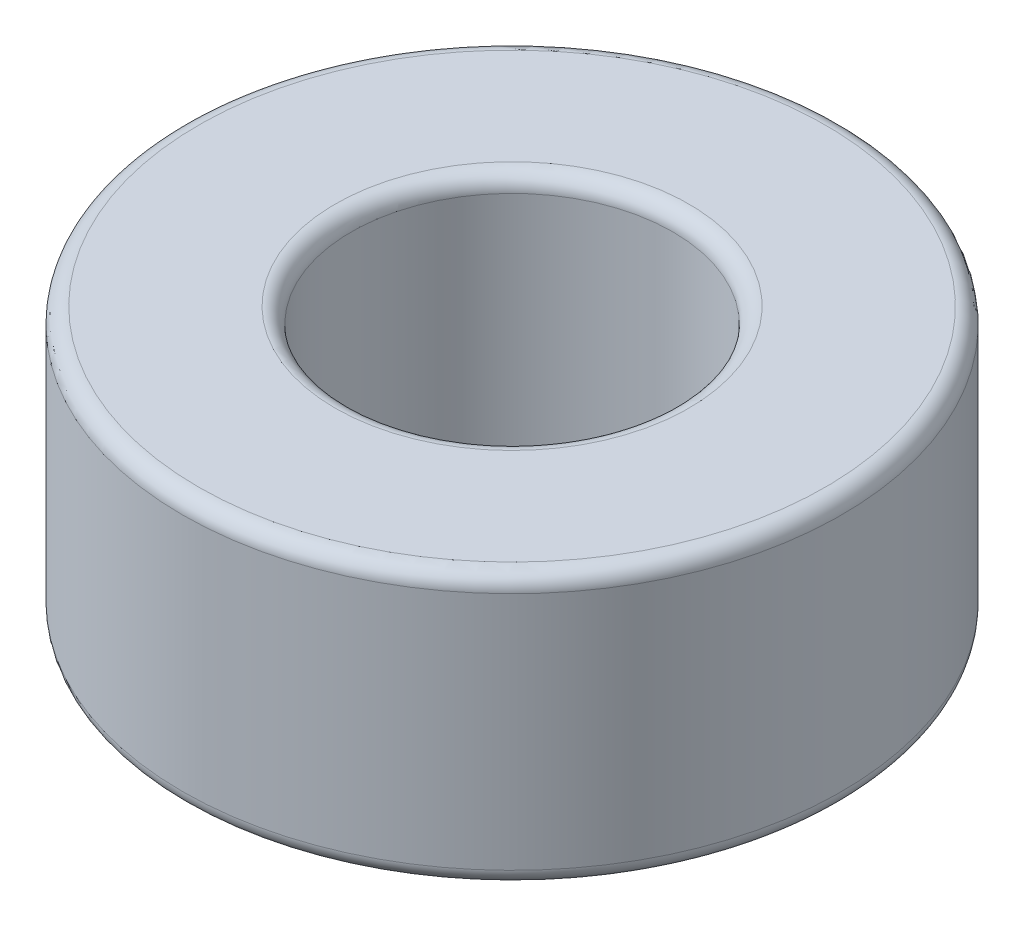
from build123d import *

# Parameters (mm, degrees)
SKETCH1_R           = 20.5
SKETCH1_R_2         = 10
BOSS_EXTRUDE1_DEPTH = 16.9
FILLET1_R           = 1


with BuildPart() as part:
    # Sketch1 → Boss-Extrude1 (new body)
    with BuildSketch(Plane(origin=(0, 0, 0), x_dir=(1, 0, 0), z_dir=(0, 1, 0))):
        with Locations(Location((0, 0, 0), (0, 0, 270))):
            Circle(SKETCH1_R)
        with Locations(Location((0, 0, 0), (0, 0, 270))):
            Circle(SKETCH1_R_2, mode=Mode.SUBTRACT)
    extrude(amount=BOSS_EXTRUDE1_DEPTH)

    # Fillet1
    fillet1_edges = [part.edges().sort_by_distance(p)[0] for p in [
        (0, 0, -20.5),
        (0, 16.9, -20.5),
        (0, 0, -10),
        (0, 16.9, -10),
    ]]
    fillet(fillet1_edges, radius=FILLET1_R)


solid = part.part
